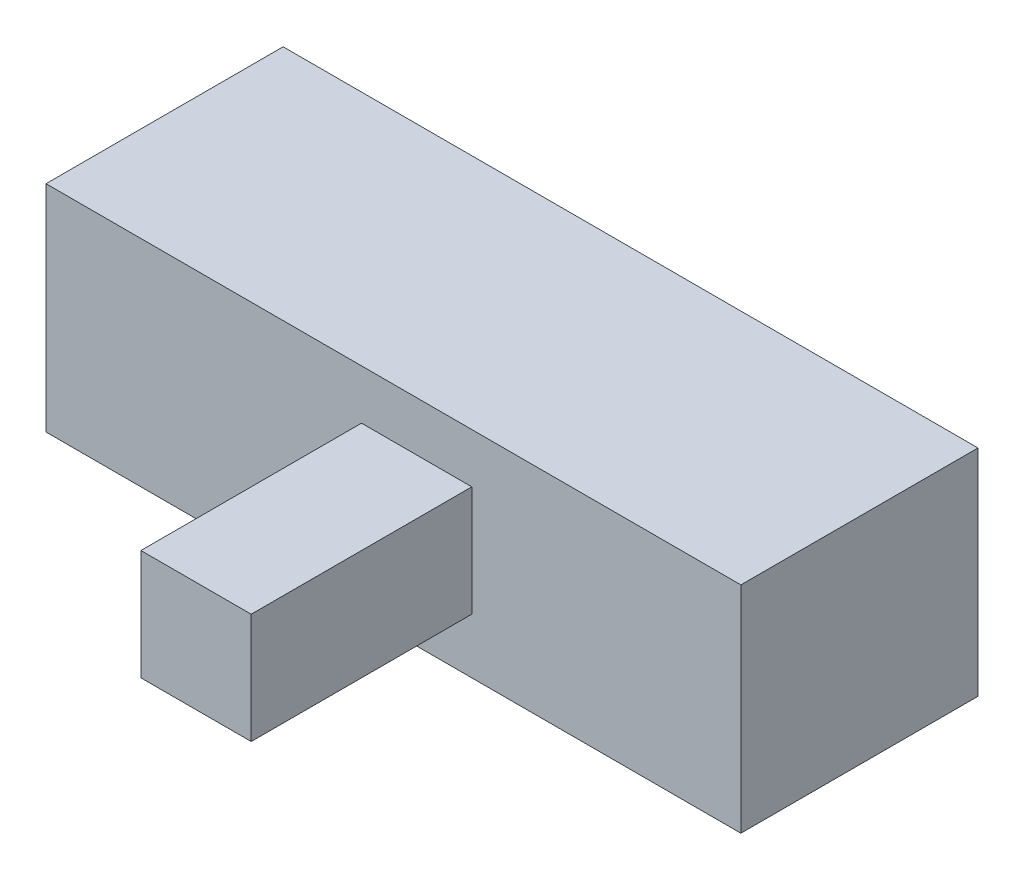
from build123d import *

# Parameters (mm, degrees)
SKETCH1_W           = 12.6
SKETCH1_H           = 3.9
BOSS_EXTRUDE1_DEPTH = 4.3
SKETCH2_W           = 2
SKETCH2_H           = 2
BOSS_EXTRUDE2_DEPTH = 4


with BuildPart() as part:
    # Sketch1 → Boss-Extrude1 (new body)
    with BuildSketch(Plane.XY):
        with Locations((6.3, 1.95)):
            Rectangle(SKETCH1_W, SKETCH1_H)
    extrude(amount=BOSS_EXTRUDE1_DEPTH)

    # Sketch2 → Boss-Extrude2 (add)
    with BuildSketch(Plane.XY.offset(4.3)):
        with Locations((6.720978675, 2)):
            Rectangle(SKETCH2_W, SKETCH2_H)
    extrude(amount=BOSS_EXTRUDE2_DEPTH)


solid = part.part
